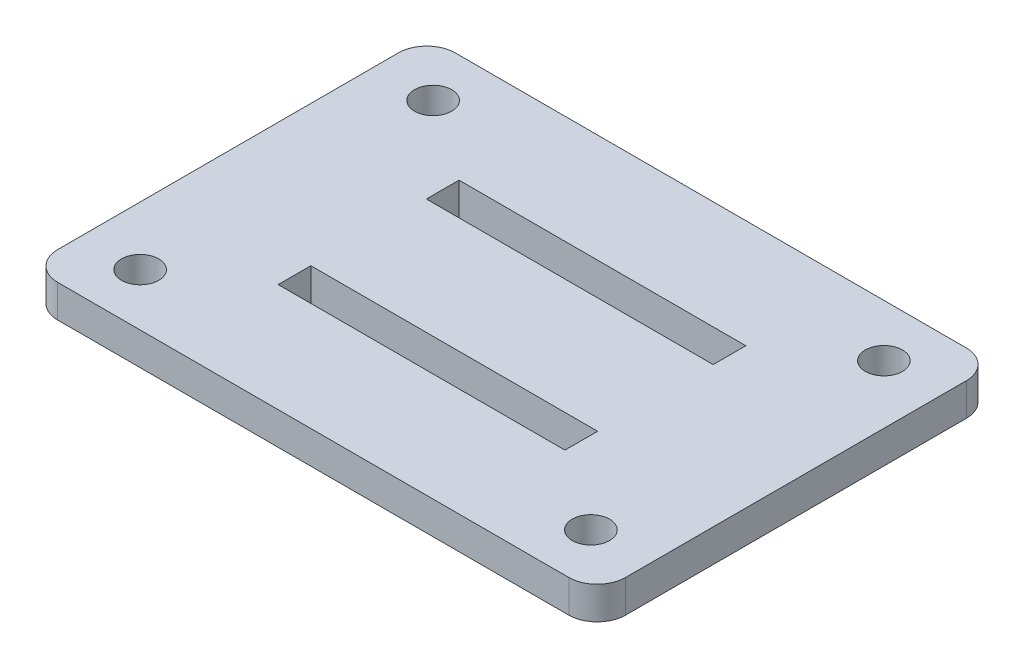
from build123d import *

# Parameters (mm, degrees)
SKETCH_3_W          = 80
SKETCH_3_H          = 56
EXTRUDE_1_DEPTH     = 4.6
SKETCH_1_R          = 2.625
SKETCH_1_W          = 40.4
SKETCH_1_H          = 4.6
CUT_EXTRUDE_1_DEPTH = 4.6
FILLET_2_R          = 4


with BuildPart() as part:
    # 草图3 → 凸台-拉伸1 (new body)
    with BuildSketch(Plane(origin=(0, 0, 0), x_dir=(1, 0, 0), z_dir=(0, 1, 0))):
        Rectangle(SKETCH_3_W, SKETCH_3_H)
    extrude(amount=EXTRUDE_1_DEPTH)

    # 草图1 → 切除-拉伸1 (cut)
    with BuildSketch(Plane(origin=(0, 0, 0), x_dir=(1, 0, 0), z_dir=(0, 1, 0))):
        with Locations(Location((-31.75, 20.6375, 0), (0, 0, 90))):
            Circle(SKETCH_1_R)
        with Locations(Location((31.75, 20.6375, 0), (0, 0, 90))):
            Circle(SKETCH_1_R)
        with Locations(Location((31.75, -20.6375, 0), (0, 0, 90))):
            Circle(SKETCH_1_R)
        with Locations(Location((-31.75, -20.6375, 0), (0, 0, 90))):
            Circle(SKETCH_1_R)
        with Locations((0, -10.4375)):
            Rectangle(SKETCH_1_W, SKETCH_1_H)
        with Locations((0, 10.4375)):
            Rectangle(SKETCH_1_W, SKETCH_1_H)
    extrude(amount=CUT_EXTRUDE_1_DEPTH, mode=Mode.SUBTRACT)

    # 圆角2
    fillet_2_edges = [part.edges().sort_by_distance(p)[0] for p in [
        (40, 2.3, 28),
        (-40, 2.3, 28),
        (-40, 2.3, -28),
        (40, 2.3, -28),
    ]]
    fillet(fillet_2_edges, radius=FILLET_2_R)


solid = part.part
